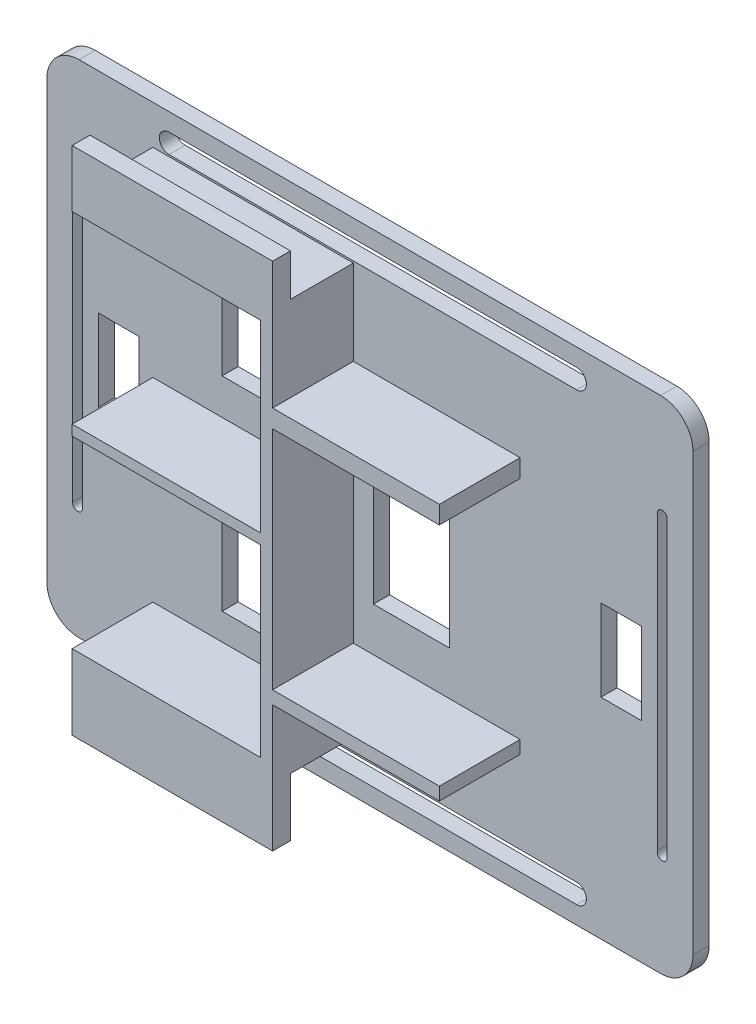
from build123d import *

# Parameters (mm, degrees)
CROQUIS2_W              = 200
CROQUIS2_H              = 155
CROQUIS2_W_2            = 31.297292299
CROQUIS2_H_2            = 43.768728426
CROQUIS2_H_3            = 43.768728427
CROQUIS2_W_3            = 23.573907934
CROQUIS2_H_4            = 45.323962431
SALIENTE_EXTRUIR1_DEPTH = 5
REDONDEO1_R             = 10
BOSS_EXTRUDE1_DEPTH     = 25
SKETCH3_W               = 62.040442094
SKETCH3_H               = 5.530821024
BOSS_EXTRUDE2_DEPTH     = 18
SKETCH8_W               = 62.040442094
SKETCH8_H               = 5.530821024
BOSS_EXTRUDE6_DEPTH     = 13


with BuildPart() as part:
    # Croquis2 → Saliente-Extruir1 (new body)
    with BuildSketch(Plane.XY):
        with Locations((0.108263467, -0.443414783)):
            Rectangle(CROQUIS2_W, CROQUIS2_H)
        with BuildLine():
            Line((-62.091736533, 71.556585217), (64.108263467, 71.556585217))
            ThreePointArc((64.108263467, 71.556585217), (67.108263467, 68.556585217), (64.108263467, 65.556585217))
            Line((64.108263467, 65.556585217), (-62.091736533, 65.556585217))
            ThreePointArc((-62.091736533, 65.556585217), (-65.091736533, 68.556585217), (-62.091736533, 71.556585217))
        make_face(mode=Mode.SUBTRACT)
        Polygon((-71.391736533, -12.98578064), (-71.391736533, 12.098951074), (-79.241736533, 12.123251884), (-83.891736533, 12.206585217), (-83.891736533, -13.093414783), (-79.241736533, -13.01008145), align=None, mode=Mode.SUBTRACT)
        with BuildLine():
            Line((92.108263467, 45.395048424), (92.108263467, -46.28187799))
            ThreePointArc((92.108263467, -46.28187799), (90.189031864, -47.362646387), (89.108263467, -45.443414783))
            Line((89.108263467, -45.443414783), (89.108263467, 44.556585217))
            ThreePointArc((89.108263467, 44.556585217), (90.189031864, 46.47581682), (92.108263467, 45.395048424))
        make_face(mode=Mode.SUBTRACT)
        Polygon((84.108263467, 12.206585217), (84.108263467, -13.093414783), (79.458263467, -13.093414783), (71.608263467, -13.093414783), (71.608263467, 12.206585217), (79.458263467, 12.206585217), align=None, mode=Mode.SUBTRACT)
        with BuildLine():
            Line((-91.891736533, 41.658521059), (-91.891736533, -42.545350625))
            ThreePointArc((-91.891736533, -42.545350625), (-90.590768612, -44.244382704), (-88.891736533, -42.943414783))
            Line((-88.891736533, -42.943414783), (-88.891736533, 42.056585217))
            ThreePointArc((-88.891736533, 42.056585217), (-90.590768612, 43.357553138), (-91.891736533, 41.658521059))
        make_face(mode=Mode.SUBTRACT)
        with Locations((-30.011405388, 36.299005811)):
            Rectangle(CROQUIS2_W_2, CROQUIS2_H_2, mode=Mode.SUBTRACT)
        with BuildLine():
            Line((-62.091736533, -72.443414783), (64.108263467, -72.443414783))
            ThreePointArc((64.108263467, -72.443414783), (67.108263467, -69.443414783), (64.108263467, -66.443414783))
            Line((64.108263467, -66.443414783), (-62.091736533, -66.443414783))
            ThreePointArc((-62.091736533, -66.443414783), (-65.091736533, -69.443414783), (-62.091736533, -72.443414783))
        make_face(mode=Mode.SUBTRACT)
        with Locations((-30.011405388, -26.799059535)):
            Rectangle(CROQUIS2_W_2, CROQUIS2_H_3, mode=Mode.SUBTRACT)
        with Locations((12.982877294, -0.693345879)):
            Rectangle(CROQUIS2_W_3, CROQUIS2_H_4, mode=Mode.SUBTRACT)
    extrude(amount=SALIENTE_EXTRUIR1_DEPTH)

    # Redondeo1
    redondeo1_edges = [part.edges().sort_by_distance(p)[0] for p in [
        (100.108263467, -77.943414783, 2.5),
        (-99.891736533, -77.943414783, 2.5),
        (-99.891736533, 77.056585217, 2.5),
        (100.108263467, 77.056585217, 2.5),
    ]]
    fillet(redondeo1_edges, radius=REDONDEO1_R)

    # Sketch1 → Boss-Extrude1 (add)
    with BuildSketch(Plane.XY.offset(5)):
        Polygon((-67.071845217, 64.976726992), (-67.071845217, 60.27797041), (-8.841198185, 60.27797041), (-8.841198185, 3.27797041), (-67.071845217, 3.27797041), (-67.071845217, 0.070097884), (-8.841198185, 0.070097884), (-8.841198185, -56.929902116), (-67.071845217, -56.929902116), (-67.071845217, -62.150742763), (-5.031403123, -62.150742763), (-5.031403123, -40.931443482), (46.608263467, -40.931443482), (46.608263467, -36.931443482), (-5.031403123, -36.931443482), (-5.031403123, 33.068556518), (46.608263467, 33.068556518), (46.608263467, 38.611481725), (-5.031403123, 38.611481725), (-5.031403123, 64.976726992), align=None)
    extrude(amount=BOSS_EXTRUDE1_DEPTH)

    # Sketch3 → Boss-Extrude2 (add)
    with BuildSketch(Plane.XZ.offset(62.150742763)):
        with Locations((-36.05162417, 27.234589488)):
            Rectangle(SKETCH3_W, SKETCH3_H)
    extrude(amount=BOSS_EXTRUDE2_DEPTH)

    # Sketch8 → Boss-Extrude6 (add)
    with BuildSketch(Plane(origin=(0, 64.976726992, 0), x_dir=(1, 0, 0), z_dir=(0, 1, 0))):
        with Locations((-36.05162417, -27.234589488)):
            Rectangle(SKETCH8_W, SKETCH8_H)
    extrude(amount=BOSS_EXTRUDE6_DEPTH)


solid = part.part
